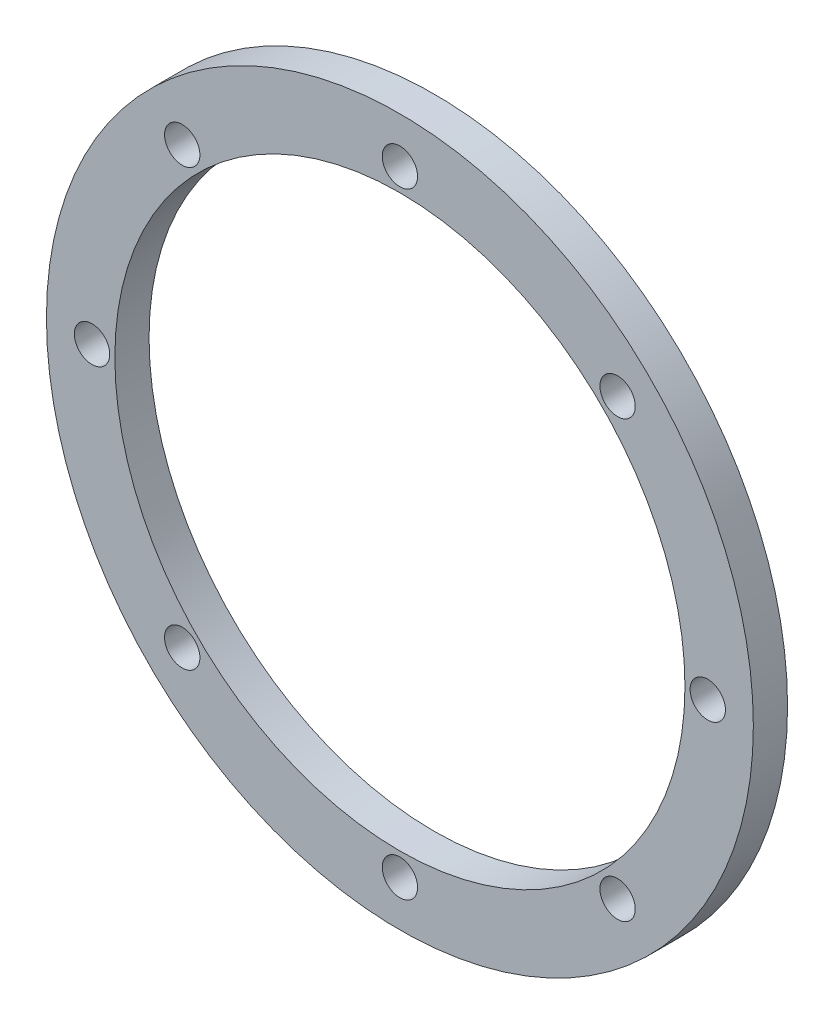
from build123d import *

# Parameters (mm, degrees)
SKETCH1_R           = 31
SKETCH1_R_2         = 1.55
SKETCH1_R_3         = 25
BOSS_EXTRUDE1_DEPTH = 3


with BuildPart() as part:
    # Sketch1 → Boss-Extrude1 (new body)
    with BuildSketch(Plane.XY):
        Circle(SKETCH1_R)
        with Locations((-27, 0)):
            Circle(SKETCH1_R_2, mode=Mode.SUBTRACT)
        with Locations((-19.091883092, 19.091883092)):
            Circle(SKETCH1_R_2, mode=Mode.SUBTRACT)
        with Locations((0, 27)):
            Circle(SKETCH1_R_2, mode=Mode.SUBTRACT)
        with Locations((19.091883092, 19.091883092)):
            Circle(SKETCH1_R_2, mode=Mode.SUBTRACT)
        with Locations((27, 0)):
            Circle(SKETCH1_R_2, mode=Mode.SUBTRACT)
        with Locations((19.091883092, -19.091883092)):
            Circle(SKETCH1_R_2, mode=Mode.SUBTRACT)
        with Locations((0, -27)):
            Circle(SKETCH1_R_2, mode=Mode.SUBTRACT)
        with Locations((-19.091883092, -19.091883092)):
            Circle(SKETCH1_R_2, mode=Mode.SUBTRACT)
        Circle(SKETCH1_R_3, mode=Mode.SUBTRACT)
    extrude(amount=BOSS_EXTRUDE1_DEPTH)


solid = part.part
